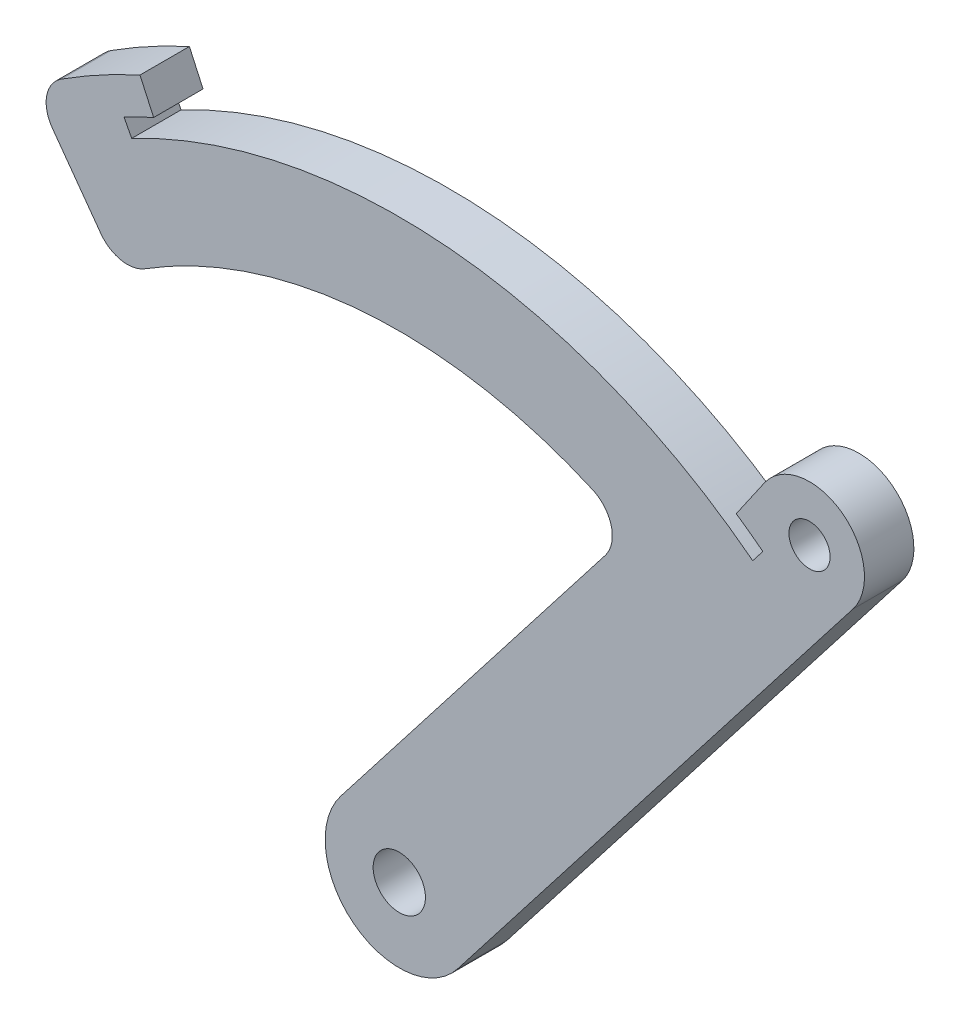
from build123d import *

# Parameters (mm, degrees)
SKETCH1_R           = 1.5875
SKETCH1_R_2         = 1.25
BOSS_EXTRUDE1_DEPTH = 3


with BuildPart() as part:
    # Sketch1 → Boss-Extrude1 (new body)
    with BuildSketch(Plane.XY):
        with BuildLine():
            Line((-14.954240874, 193.488256671), (-38.94528665, 162.581960817))
            ThreePointArc((-38.94528665, 162.581960817), (-45.259350105, 161.786597572), (-46.05471335, 168.100661026))
            Line((-46.05471335, 168.100661026), (-29.985536617, 188.801664845))
            ThreePointArc((-29.985536617, 188.801664845), (-29.626045817, 190.516785549), (-30.755439529, 191.856689466))
            ThreePointArc((-30.755439529, 191.856689466), (-44.594733066, 194.265558421), (-57.942527266, 189.887763856))
            ThreePointArc((-57.942527266, 189.887763856), (-59.388320452, 189.617207801), (-60.628151377, 190.408622856))
            Line((-60.628151377, 190.408622856), (-63.563416093, 194.467459011))
            ThreePointArc((-63.563416093, 194.467459011), (-63.907898099, 196.011433745), (-63.022949076, 197.322689273))
            ThreePointArc((-63.022949076, 197.322689273), (-60.680350979, 198.710081326), (-58.244425957, 199.926178296))
            Line((-58.244425957, 199.926178296), (-57.415771959, 198.105922118))
            ThreePointArc((-57.415771959, 198.105922118), (-58.320144396, 197.678952012), (-59.212307575, 197.227025207))
            Line((-59.212307575, 197.227025207), (-58.748076809, 196.341310922))
            ThreePointArc((-58.748076809, 196.341310922), (-39.400871452, 200.203832377), (-21.038388075, 192.989081421))
            Line((-21.038388075, 192.989081421), (-20.425199163, 193.779017721))
            ThreePointArc((-20.425199163, 193.779017721), (-21.223653619, 194.381233178), (-22.038528177, 194.961036964))
            Line((-22.038528177, 194.961036964), (-20.333405525, 197.429347468))
            ThreePointArc((-20.333405525, 197.429347468), (-15.617758617, 198.224162104), (-14.954240874, 193.488256671))
        make_face()
        with Locations((-42.5, 165.341310922)):
            Circle(SKETCH1_R, mode=Mode.SUBTRACT)
        with Locations((-17.589064697, 195.53354153)):
            Circle(SKETCH1_R_2, mode=Mode.SUBTRACT)
    extrude(amount=-BOSS_EXTRUDE1_DEPTH)


solid = part.part
